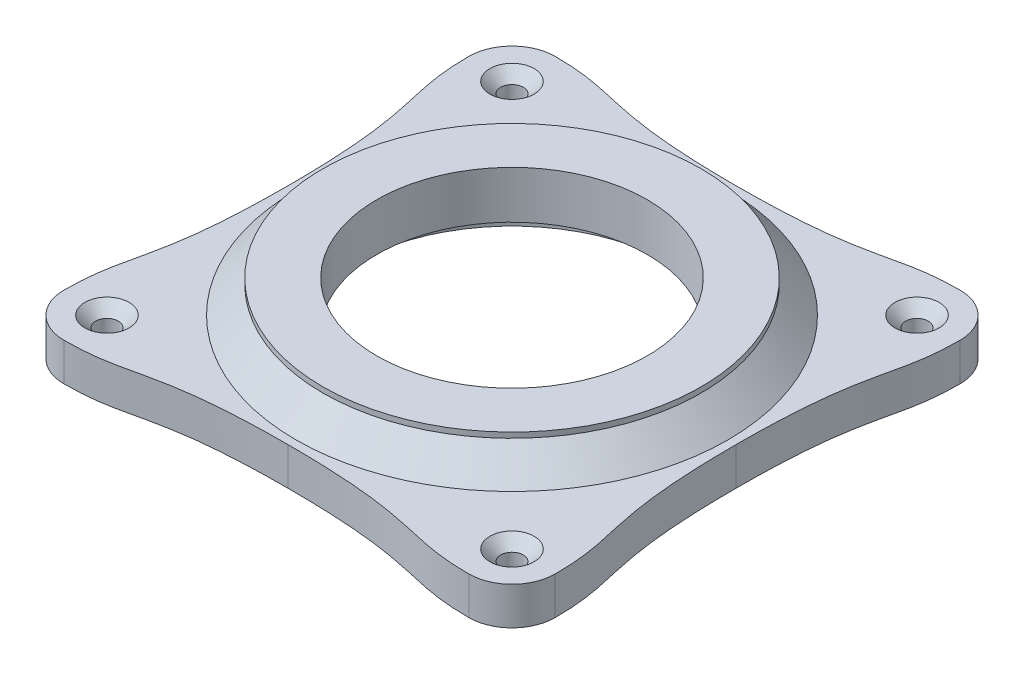
from build123d import *

# Parameters (mm, degrees)
SKETCH1_R           = 2.1
SKETCH1_R_2         = 25.05
BOSS_EXTRUDE1_DEPTH = 7
SKETCH5_R           = 30.1
SKETCH5_R_2         = 25.05
CUT_EXTRUDE1_DEPTH  = 4.2
SKETCH6_R           = 35
SKETCH6_R_2         = 25.05
BOSS_EXTRUDE4_DEPTH = 6
CHAMFER1_SIZE       = 2
CHAMFER2_SIZE       = 5


with BuildPart() as part:
    # Sketch1 → Boss-Extrude1 (new body)
    with BuildSketch(Plane(origin=(0, 0, 0), x_dir=(1, 0, 0), z_dir=(0, 1, 0))):
        with BuildLine():
            ThreePointArc((0, 83), (-5.656854249, 80.656854249), (-8, 75))
            add(Edge.make_bspline(
                [(-8, 75), (-8, 62.5), (-4, 62.5), (-4, 37.5)],
                knots=[0, 0, 0, 0, 1, 1, 1, 1], degree=3))
            add(Edge.make_bspline(
                [(-8, 0), (-8, 12.5), (-4, 12.5), (-4, 37.5)],
                knots=[0, 0, 0, 0, 1, 1, 1, 1], degree=3))
            ThreePointArc((-8, 0), (-5.656854249, -5.656854249), (0, -8))
            add(Edge.make_bspline(
                [(0, -8), (12.5, -8), (12.5, -4), (37.5, -4)],
                knots=[0, 0, 0, 0, 1, 1, 1, 1], degree=3))
            add(Edge.make_bspline(
                [(75, -8), (62.5, -8), (62.5, -4), (37.5, -4)],
                knots=[0, 0, 0, 0, 1, 1, 1, 1], degree=3))
            ThreePointArc((75, -8), (80.656854249, -5.656854249), (83, 0))
            add(Edge.make_bspline(
                [(83, 0), (83, 12.5), (79, 12.5), (79, 37.5)],
                knots=[0, 0, 0, 0, 1, 1, 1, 1], degree=3))
            add(Edge.make_bspline(
                [(83, 75), (83, 62.5), (79, 62.5), (79, 37.5)],
                knots=[0, 0, 0, 0, 1, 1, 1, 1], degree=3))
            ThreePointArc((83, 75), (80.656854249, 80.656854249), (75, 83))
            add(Edge.make_bspline(
                [(75, 83), (62.5, 83), (62.5, 79), (37.5, 79)],
                knots=[0, 0, 0, 0, 1, 1, 1, 1], degree=3))
            add(Edge.make_bspline(
                [(0, 83), (12.5, 83), (12.5, 79), (37.5, 79)],
                knots=[0, 0, 0, 0, 1, 1, 1, 1], degree=3))
        make_face()
        with Locations(Location((0, 75, 0), (0, 0, 270))):
            Circle(SKETCH1_R, mode=Mode.SUBTRACT)
        with Locations(Location((75, 75, 0), (0, 0, 270))):
            Circle(SKETCH1_R, mode=Mode.SUBTRACT)
        with Locations(Location((75, 0, 0), (0, 0, 270))):
            Circle(SKETCH1_R, mode=Mode.SUBTRACT)
        with Locations(Location((0, 0, 0), (0, 0, 270))):
            Circle(SKETCH1_R, mode=Mode.SUBTRACT)
        with Locations(Location((37.5, 37.5, 0), (0, 0, 270))):
            Circle(SKETCH1_R_2, mode=Mode.SUBTRACT)
    extrude(amount=BOSS_EXTRUDE1_DEPTH)

    # Sketch5 → Cut-Extrude1 (cut)
    with BuildSketch(Plane.XZ):
        with Locations(Location((37.5, -37.5, 0), (0, 0, 270))):
            Circle(SKETCH5_R)
        with Locations(Location((37.5, -37.5, 0), (0, 0, 270))):
            Circle(SKETCH5_R_2, mode=Mode.SUBTRACT)
    extrude(amount=-CUT_EXTRUDE1_DEPTH, mode=Mode.SUBTRACT)

    # Sketch6 → Boss-Extrude4 (add)
    with BuildSketch(Plane(origin=(0, 7, 0), x_dir=(1, 0, 0), z_dir=(0, 1, 0))):
        with Locations(Location((37.5, 37.5, 0), (0, 0, 270))):
            Circle(SKETCH6_R)
        with Locations(Location((37.5, 37.5, 0), (0, 0, 90))):
            Circle(SKETCH6_R_2, mode=Mode.SUBTRACT)
    extrude(amount=BOSS_EXTRUDE4_DEPTH)

    # Chamfer1
    chamfer1_edges = [part.edges().sort_by_distance(p)[0] for p in [
        (0, 7, -77.1),
        (75, 7, -77.1),
        (75, 7, -2.1),
        (0, 7, -2.1),
    ]]
    chamfer(chamfer1_edges, length=CHAMFER1_SIZE)

    # Chamfer2
    chamfer2_edges = [part.edges().sort_by_distance(p)[0] for p in [
        (37.5, 7, -72.5),
    ]]
    chamfer(chamfer2_edges, length=CHAMFER2_SIZE)


solid = part.part
